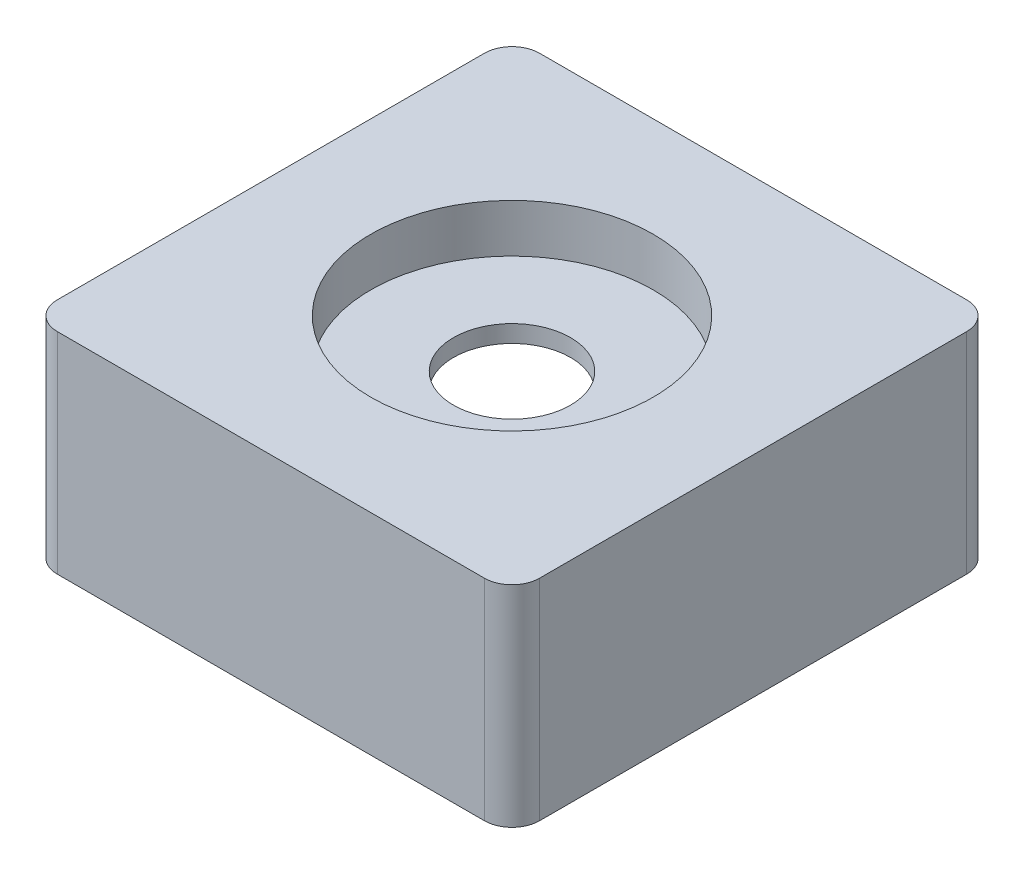
from build123d import *

# Parameters (mm, degrees)
SKETCH_1_W          = 140
SKETCH_1_H          = 140
SKETCH_1_R          = 41
EXTRUDE_1_DEPTH     = 14
SKETCH_3_W          = 140
SKETCH_3_H          = 140
SKETCH_3_R          = 17
EXTRUDE_2_DEPTH     = 5
SKETCH_4_W          = 140
SKETCH_4_H          = 140
SKETCH_4_W_2        = 120
SKETCH_4_H_2        = 120
EXTRUDE_3_DEPTH     = 42
FILLET_3_R          = 8
CUT_EXTRUDE_1_DEPTH = 6


with BuildPart() as part:
    # 草图1 → 凸台-拉伸1 (new body)
    with BuildSketch(Plane(origin=(0, 0, 0), x_dir=(1, 0, 0), z_dir=(0, 1, 0))):
        Rectangle(SKETCH_1_W, SKETCH_1_H)
        with Locations(Location((0, 0, 0), (0, 0, 270))):
            Circle(SKETCH_1_R, mode=Mode.SUBTRACT)
    extrude(amount=EXTRUDE_1_DEPTH)

    # 草图3 → 凸台-拉伸2 (add)
    with BuildSketch(Plane.XZ):
        Rectangle(SKETCH_3_W, SKETCH_3_H)
        with Locations(Location((0, 0, 0), (0, 0, 270))):
            Circle(SKETCH_3_R, mode=Mode.SUBTRACT)
    extrude(amount=EXTRUDE_2_DEPTH)

    # 草图4 → 凸台-拉伸3 (add)
    with BuildSketch(Plane.XZ.offset(5)):
        Rectangle(SKETCH_4_W, SKETCH_4_H)
        Rectangle(SKETCH_4_W_2, SKETCH_4_H_2, mode=Mode.SUBTRACT)
    extrude(amount=EXTRUDE_3_DEPTH)

    # 圆角3
    fillet_3_edges = [part.edges().sort_by_distance(p)[0] for p in [
        (70, -16.5, 70),
        (-70, -16.5, 70),
        (-70, -16.5, -70),
        (70, -16.5, -70),
    ]]
    fillet(fillet_3_edges, radius=FILLET_3_R)

    # 草图5 → 切除-拉伸1 (cut)
    with BuildSketch(Plane.ZY.offset(70)):
        with BuildLine():
            Line((-10, -32), (-10, -47))
            Line((-10, -47), (10, -47))
            Line((10, -47), (10, -32))
            ThreePointArc((10, -32), (0, -22), (-10, -32))
        make_face()
    extrude(amount=-CUT_EXTRUDE_1_DEPTH, mode=Mode.SUBTRACT)


solid = part.part
